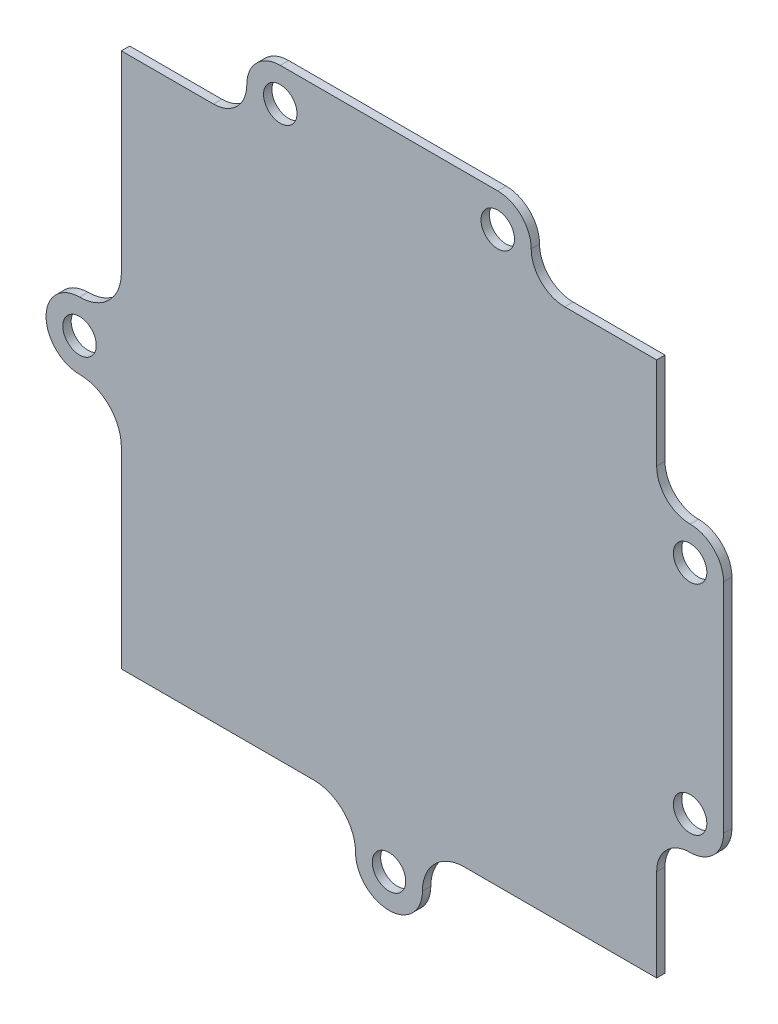
from build123d import *

# Parameters (mm, degrees)
SKETCH1_R           = 2
SKETCH1_W           = 56
SKETCH1_H           = 56
BOSS_EXTRUDE1_DEPTH = 1
SKETCH3_W           = 56
SKETCH3_H           = 56
BOSS_EXTRUDE3_DEPTH = 1


with BuildPart() as part:
    # Sketch1 → Boss-Extrude1 (new body)
    with BuildSketch(Plane.XY):
        with BuildLine():
            Line((40, -13), (40, 13))
            ThreePointArc((40, 13), (38.828427125, 15.828427125), (36, 17))
            ThreePointArc((36, 17), (33.171572875, 18.171572875), (32, 21))
            Line((32, 21), (32, 32))
            Line((32, 32), (21, 32))
            ThreePointArc((21, 32), (18.171572875, 33.171572875), (17, 36))
            ThreePointArc((17, 36), (15.828427125, 38.828427125), (13, 40))
            Line((13, 40), (-13, 40))
            ThreePointArc((-13, 40), (-15.828427125, 38.828427125), (-17, 36))
            ThreePointArc((-17, 36), (-18.171572875, 33.171572875), (-21, 32))
            Line((-21, 32), (-32, 32))
            Line((-32, 32), (-32, 9))
            ThreePointArc((-32, 9), (-33.464466094, 5.464466094), (-37, 4))
            ThreePointArc((-37, 4), (-41, 0), (-37, -4))
            ThreePointArc((-37, -4), (-33.464466094, -5.464466094), (-32, -9))
            Line((-32, -9), (-32, -32))
            Line((-32, -32), (-9, -32))
            ThreePointArc((-9, -32), (-5.464466094, -33.464466094), (-4, -37))
            ThreePointArc((-4, -37), (0, -41), (4, -37))
            ThreePointArc((4, -37), (5.464466094, -33.464466094), (9, -32))
            Line((9, -32), (32, -32))
            Line((32, -32), (32, -21))
            ThreePointArc((32, -21), (33.171572875, -18.171572875), (36, -17))
            ThreePointArc((36, -17), (38.828427125, -15.828427125), (40, -13))
        make_face()
        with Locations((-37, 0)):
            Circle(SKETCH1_R, mode=Mode.SUBTRACT)
        with Locations((-13, 36)):
            Circle(SKETCH1_R, mode=Mode.SUBTRACT)
        with Locations((0, -37)):
            Circle(SKETCH1_R, mode=Mode.SUBTRACT)
        with Locations((36, -13)):
            Circle(SKETCH1_R, mode=Mode.SUBTRACT)
        with Locations((36, 13)):
            Circle(SKETCH1_R, mode=Mode.SUBTRACT)
        with Locations((13, 36)):
            Circle(SKETCH1_R, mode=Mode.SUBTRACT)
        Rectangle(SKETCH1_W, SKETCH1_H, mode=Mode.SUBTRACT)
    extrude(amount=BOSS_EXTRUDE1_DEPTH)

    # Sketch3 → Boss-Extrude3 (add)
    with BuildSketch(Plane.XY.offset(1)):
        Rectangle(SKETCH3_W, SKETCH3_H)
    extrude(amount=-BOSS_EXTRUDE3_DEPTH)


solid = part.part
